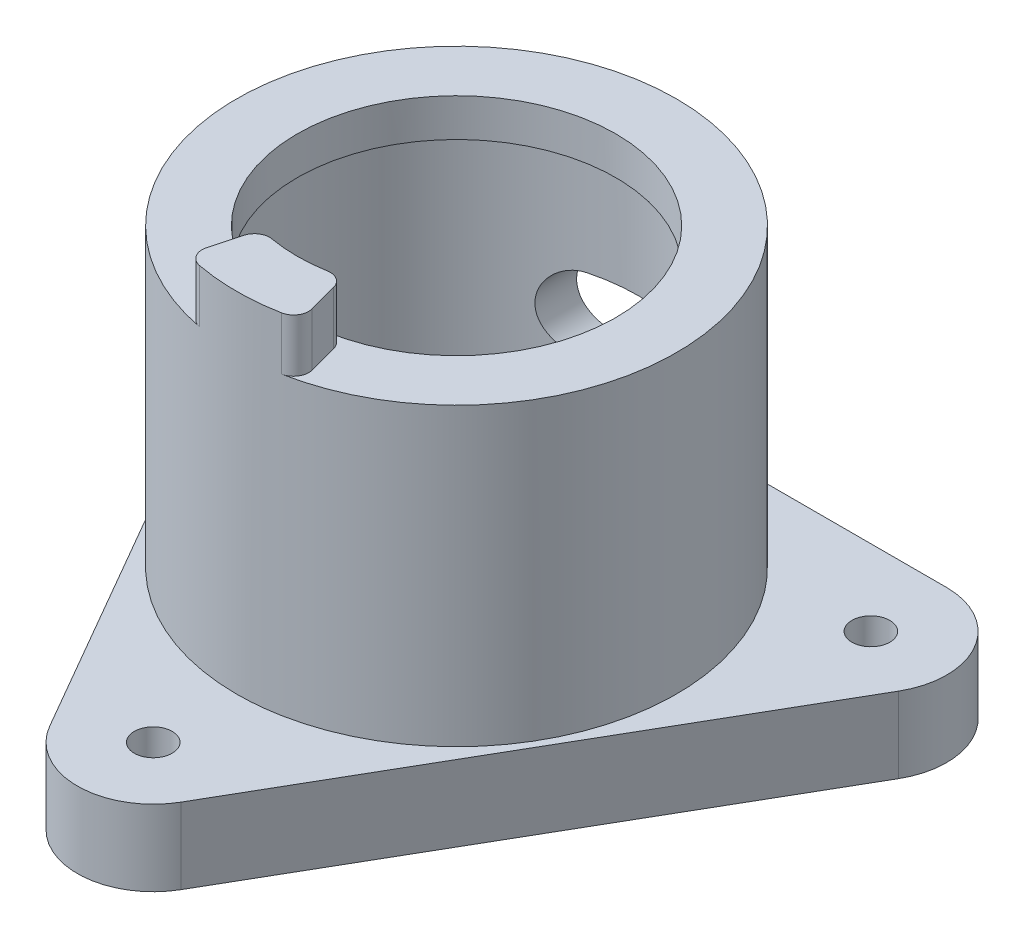
from build123d import *

# Parameters (mm, degrees)
SKETCH_1_R             = 12
EXTRUDE_4_DEPTH        = 5
SKETCH_5_R             = 1.25
CUT_EXTRUDE_M3_1_DEPTH = 5
SKETCH_6_R             = 14.5
SKETCH_6_R_2           = 12
EXTRUDE_5_DEPTH        = 17
SKETCH_7_R             = 14.5
SKETCH_7_R_2           = 10.5
EXTRUDE_6_DEPTH        = 2.5
EXTRUDE_7_DEPTH        = 3.5
CUT_EXTRUDE_3_DEPTH    = 44.671559


with BuildPart() as part:
    # 草图1 → 凸台-拉伸4 (new body)
    with BuildSketch(Plane(origin=(0, 0, 0), x_dir=(1, 0, 0), z_dir=(0, 1, 0))):
        with BuildLine():
            Line((-21.650635, 7.5), (-4.330127, -22.5))
            ThreePointArc((-4.330127, -22.5), (0, -25), (4.330127, -22.5))
            Line((4.330127, -22.5), (21.650635, 7.5))
            ThreePointArc((21.650635, 7.5), (21.650635, 12.5), (17.320508, 15))
            Line((17.320508, 15), (-17.320508, 15))
            ThreePointArc((-17.320508, 15), (-21.650635, 12.5), (-21.650635, 7.5))
        make_face()
        with Locations(Location((0, 0, 0), (0, 0, 270))):
            Circle(SKETCH_1_R, mode=Mode.SUBTRACT)
    extrude(amount=EXTRUDE_4_DEPTH)

    # 草图5 → M3螺纹孔1 (cut)
    with BuildSketch(Plane(origin=(0, 5, 0), x_dir=(1, 0, 0), z_dir=(0, 1, 0))):
        with Locations(Location((0, -20, 0), (0, 0, 270))):
            Circle(SKETCH_5_R)
        with Locations(Location((-17.320508, 10, 0), (0, 0, 270))):
            Circle(SKETCH_5_R)
        with Locations(Location((17.320508, 10, 0), (0, 0, 270))):
            Circle(SKETCH_5_R)
    extrude(amount=-CUT_EXTRUDE_M3_1_DEPTH, mode=Mode.SUBTRACT)

    # 草图6 → 凸台-拉伸5 (add)
    with BuildSketch(Plane(origin=(0, 5, 0), x_dir=(1, 0, 0), z_dir=(0, 1, 0))):
        with Locations(Location((0, 0, 0), (0, 0, 270))):
            Circle(SKETCH_6_R)
        with Locations(Location((0, 0, 0), (0, 0, 270))):
            Circle(SKETCH_6_R_2, mode=Mode.SUBTRACT)
    extrude(amount=EXTRUDE_5_DEPTH)

    # 草图7 → 凸台-拉伸6 (add)
    with BuildSketch(Plane(origin=(0, 22, 0), x_dir=(1, 0, 0), z_dir=(0, 1, 0))):
        with Locations(Location((0, 0, 0), (0, 0, 270))):
            Circle(SKETCH_7_R)
        with Locations(Location((0, 0, 0), (0, 0, 270))):
            Circle(SKETCH_7_R_2, mode=Mode.SUBTRACT)
    extrude(amount=EXTRUDE_6_DEPTH)

    # 草图8 → 凸台-拉伸7 (add)
    with BuildSketch(Plane(origin=(0, 24.5, 0), x_dir=(1, 0, 0), z_dir=(0, 1, 0))):
        with BuildLine():
            Line((2.965145, -11.066071), (3.484458, -13.004174))
            ThreePointArc((3.484458, -13.004174), (3.365431, -13.794747), (2.70509, -14.245437))
            ThreePointArc((2.70509, -14.245437), (0, -14.5), (-2.70509, -14.245437))
            ThreePointArc((-2.70509, -14.245437), (-3.365431, -13.794747), (-3.484458, -13.004174))
            Line((-3.484458, -13.004174), (-2.965145, -11.066071))
            ThreePointArc((-2.965145, -11.066071), (-2.536434, -10.481444), (-1.825374, -10.340117))
            ThreePointArc((-1.825374, -10.340117), (0, -10.5), (1.825374, -10.340117))
            ThreePointArc((1.825374, -10.340117), (2.536434, -10.481444), (2.965145, -11.066071))
        make_face()
    extrude(amount=EXTRUDE_7_DEPTH)

    # 草图9 → 切除-拉伸3 (cut, through all)
    with BuildSketch(Plane.XY):
        with BuildLine():
            Line((-3, 14.5), (3, 14.5))
            ThreePointArc((3, 14.5), (5.5, 12), (3, 9.5))
            Line((3, 9.5), (-3, 9.5))
            ThreePointArc((-3, 9.5), (-5.5, 12), (-3, 14.5))
        make_face()
    extrude(amount=-CUT_EXTRUDE_3_DEPTH, mode=Mode.SUBTRACT)


solid = part.part
